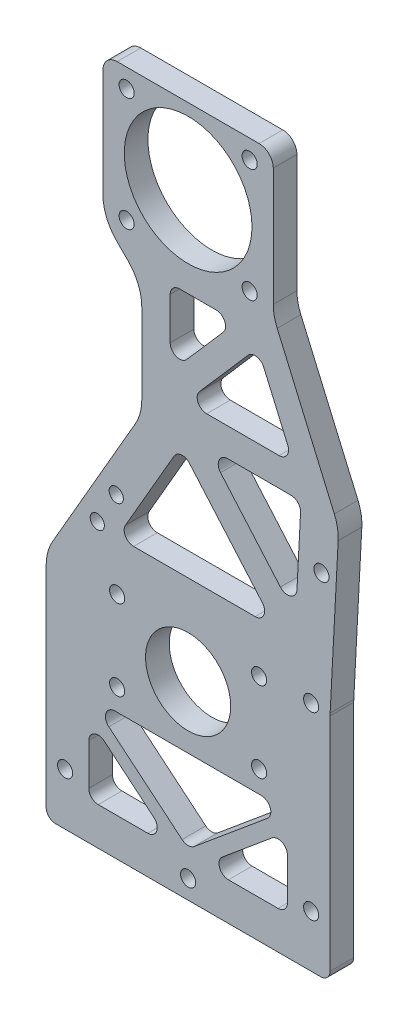
from build123d import *

# Parameters (mm, degrees)
SKETCH_1_R          = 13.5
SKETCH_1_R_2        = 1.6
EXTRUDE_1_DEPTH     = 5
SKETCH_2_R          = 9
SKETCH_2_R_2        = 1.6
CUT_EXTRUDE_1_DEPTH = 150.490789026
CUT_EXTRUDE_2_DEPTH = 150.490789026
FILLET_1_R          = 2
FILLET_2_R          = 2
SKETCH_4_R          = 1.6
SKETCH_4_R_2        = 1.5
CUT_EXTRUDE_3_DEPTH = 150.490789026


with BuildPart() as part:
    # 草图1 → 凸台-拉伸1 (new body)
    with BuildSketch(Plane.XY):
        with BuildLine():
            Line((28, 0), (-28, 0))
            ThreePointArc((-28, 0), (-29.414213562, 0.585786438), (-30, 2))
            Line((-30, 2), (-30, 46.320508076))
            ThreePointArc((-30, 46.320508076), (-29.659258263, 48.908698527), (-28.660254038, 51.320508076))
            Line((-28.660254038, 51.320508076), (-11.132486541, 81.679491924))
            ThreePointArc((-11.132486541, 81.679491924), (-10.133482315, 84.091301473), (-9.792740578, 86.679491924))
            Line((-9.792740578, 86.679491924), (-9.792740578, 103.650604955))
            ThreePointArc((-9.792740578, 103.650604955), (-10.553945253, 107.477439278), (-12.721672766, 110.721672766))
            Line((-12.721672766, 110.721672766), (-15.071067812, 113.071067812))
            ThreePointArc((-15.071067812, 113.071067812), (-17.238795325, 116.3153013), (-18, 120.142135624))
            Line((-18, 120.142135624), (-18, 143))
            ThreePointArc((-18, 143), (-17.121320344, 145.121320344), (-15, 146))
            Line((-15, 146), (15, 146))
            ThreePointArc((15, 146), (17.121320344, 145.121320344), (18, 143))
            Line((18, 143), (18, 118.069065994))
            ThreePointArc((18, 118.069065994), (18.207415327, 116.0429156), (18.821057084, 114.100816135))
            Line((18.821057084, 114.100816135), (30.90426409, 86.151198222))
            ThreePointArc((30.90426409, 86.151198222), (31.567588607, 83.952064463), (31.711616521, 81.659588801))
            Line((31.711616521, 81.659588801), (30.013704652, 49.261500347))
            ThreePointArc((30.013704652, 49.261500347), (30.00342675, 48.999910267), (30, 48.738140784))
            Line((30, 48.738140784), (30, 2))
            ThreePointArc((30, 2), (29.414213562, 0.585786438), (28, 0))
        make_face()
        with Locations((0, 130)):
            Circle(SKETCH_1_R, mode=Mode.SUBTRACT)
        with Locations((-26, 11)):
            Circle(SKETCH_1_R_2, mode=Mode.SUBTRACT)
        with Locations((0, 4)):
            Circle(SKETCH_1_R_2, mode=Mode.SUBTRACT)
        with Locations((26, 11)):
            Circle(SKETCH_1_R_2, mode=Mode.SUBTRACT)
        with Locations((-13, 142)):
            Circle(SKETCH_1_R_2, mode=Mode.SUBTRACT)
        with Locations((13, 142)):
            Circle(SKETCH_1_R_2, mode=Mode.SUBTRACT)
        with Locations((13, 118)):
            Circle(SKETCH_1_R_2, mode=Mode.SUBTRACT)
        with Locations((-13, 118)):
            Circle(SKETCH_1_R_2, mode=Mode.SUBTRACT)
    extrude(amount=EXTRUDE_1_DEPTH)

    # 草图2 → 切除-拉伸1 (cut, through all)
    with BuildSketch(Plane.XY.offset(5)):
        with Locations((0, 40)):
            Circle(SKETCH_2_R)
        with Locations((-15, 48.5)):
            Circle(SKETCH_2_R_2)
        with Locations(Location((15, 48.5, 0), (0, 0, 180))):
            Circle(SKETCH_2_R_2)
        with Locations((15, 31.5)):
            Circle(SKETCH_2_R_2)
        with Locations(Location((-15, 31.5, 0), (0, 0, 180))):
            Circle(SKETCH_2_R_2)
    extrude(amount=-CUT_EXTRUDE_1_DEPTH, mode=Mode.SUBTRACT)

    # 草图3 → 切除-拉伸2 (cut, through all)
    with BuildSketch(Plane.XY.offset(5)):
        Polygon((-21, 23), (-21, 8), (-3, 8), align=None)
        Polygon((0, 9.405124838), (-21, 26.905124838), (21, 26.905124838), align=None)
        Polygon((21, 8), (3, 8), (21, 23), align=None)
        Polygon((-14.988893001, 59), (18.546418422, 59), (-1.565548778, 82.249914202), align=None)
        Polygon((22.739690965, 63.323631779), (23.875701286, 85), (3.988894601, 85), align=None)
        Polygon((-3.792740578, 111), (-3.792740578, 94.806657793), (10.309753882, 111), align=None)
        Polygon((-0.477589836, 91), (22.271324796, 91), (14.724663463, 108.45615222), align=None)
    extrude(amount=-CUT_EXTRUDE_2_DEPTH, mode=Mode.SUBTRACT)

    # 圆角1
    fillet_1_edges = [part.edges().sort_by_distance(p)[0] for p in [
        (21, 26.905124838, 2.5),
        (0, 9.405124838, 2.5),
        (-21, 26.905124838, 2.5),
        (21, 23, 2.5),
        (21, 8, 2.5),
        (3, 8, 2.5),
        (-21, 23, 2.5),
        (-3, 8, 2.5),
        (-21, 8, 2.5),
    ]]
    fillet(fillet_1_edges, radius=FILLET_1_R)

    # 圆角2
    fillet_2_edges = [part.edges().sort_by_distance(p)[0] for p in [
        (-3.792740578, 111, 2.5),
        (10.309753882, 111, 2.5),
        (-3.792740578, 94.806657793, 2.5),
        (14.724663463, 108.45615222, 2.5),
        (22.271324796, 91, 2.5),
        (-0.477589836, 91, 2.5),
        (-14.988893001, 59, 2.5),
        (-1.565548778, 82.249914202, 2.5),
        (18.546418422, 59, 2.5),
        (3.988894601, 85, 2.5),
        (23.875701286, 85, 2.5),
        (22.739690965, 63.323631779, 2.5),
    ]]
    fillet(fillet_2_edges, radius=FILLET_2_R)

    # 草图4 → 切除-拉伸3 (cut, through all)
    with BuildSketch(Plane.XY.offset(5)):
        with Locations((25.993043669, 49.095132548)):
            Circle(SKETCH_4_R)
        with Locations((28.171937238, 74)):
            Circle(SKETCH_4_R)
        with Locations((-19.196152423, 59.712812921)):
            Circle(SKETCH_4_R_2)
        with Locations((-15.196152423, 66.641016151)):
            Circle(SKETCH_4_R_2)
    extrude(amount=-CUT_EXTRUDE_3_DEPTH, mode=Mode.SUBTRACT)


solid = part.part
